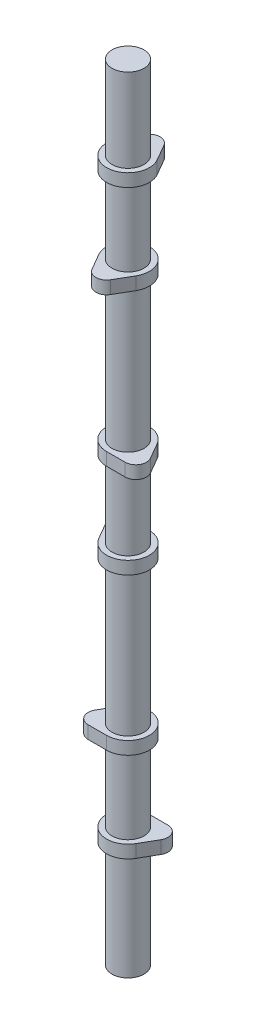
from build123d import *

# Parameters (mm, degrees)
BOSS_EXTRUDE1_DEPTH   = 7.62
LPATTERN2_COUNT       = 2
LPATTERN2_PITCH       = 53.34
BODY_MOVE_COPY1_ANGLE = 180
LPATTERN3_COUNT       = 3
LPATTERN3_PITCH       = 146.05
BODY_MOVE_COPY2_ANGLE = 120
BODY_MOVE_COPY3_ANGLE = 120
BOSS_EXTRUDE2_START   = 49.53
SKETCH3_R             = 9.5
BOSS_EXTRUDE2_DEPTH   = 466.09


with BuildPart() as part:
    # Sketch1 → Boss-Extrude1 (new body)
    with BuildSketch(Plane(origin=(0, 0, 0), x_dir=(1, 0, 0), z_dir=(0, 1, 0))):
        with BuildLine():
            Line((-5.499261314, 15.875), (-10.998522628, 6.35))
            ThreePointArc((-10.998522628, 6.35), (0, -12.7), (10.998522628, 6.35))
            Line((10.998522628, 6.35), (5.499261314, 15.875))
            ThreePointArc((5.499261314, 15.875), (0, 19.05), (-5.499261314, 15.875))
        make_face()
    extrude(amount=BOSS_EXTRUDE1_DEPTH)


with BuildPart() as lpattern2_1:
    # LPattern2: pattern copy
    add(part.part.moved(Location(Vector(0, -1, 0) * (1 * LPATTERN2_PITCH))))


with BuildPart() as lpattern2_1_1:
    # Body-Move/Copy1: moved
    add(lpattern2_1.part.rotate(Axis((0, 0, 0), (0, 1, 0)), BODY_MOVE_COPY1_ANGLE))


with BuildPart() as lpattern3_1:
    # LPattern3: pattern copy
    add(part.part.moved(Location(Vector(0, -1, 0) * (1 * LPATTERN3_PITCH))))


with BuildPart() as lpattern3_2:
    # LPattern3: pattern copy
    add(part.part.moved(Location(Vector(0, -1, 0) * (2 * LPATTERN3_PITCH))))


with BuildPart() as lpattern3_3:
    # LPattern3: pattern copy
    add(lpattern2_1_1.part.moved(Location(Vector(0, -1, 0) * (1 * LPATTERN3_PITCH))))


with BuildPart() as lpattern3_4:
    # LPattern3: pattern copy
    add(lpattern2_1_1.part.moved(Location(Vector(0, -1, 0) * (2 * LPATTERN3_PITCH))))


with BuildPart() as lpattern3_1_1:
    # Body-Move/Copy2: moved
    add(lpattern3_1.part.rotate(Axis((0, 0, 0), (0, -1, 0)), BODY_MOVE_COPY2_ANGLE))


with BuildPart() as lpattern3_3_1:
    # Body-Move/Copy2: moved
    add(lpattern3_3.part.rotate(Axis((0, 0, 0), (0, -1, 0)), BODY_MOVE_COPY2_ANGLE))


with BuildPart() as lpattern3_2_1:
    # Body-Move/Copy3: moved
    add(lpattern3_2.part.rotate(Axis((0, 0, 0), (0, 1, 0)), BODY_MOVE_COPY3_ANGLE))


with BuildPart() as lpattern3_4_1:
    # Body-Move/Copy3: moved
    add(lpattern3_4.part.rotate(Axis((0, 0, 0), (0, 1, 0)), BODY_MOVE_COPY3_ANGLE))


with BuildPart() as part_1:
    add(part.part)

    add(lpattern2_1_1.part)  # Boss-Extrude2 merges LPattern2_1

    add(lpattern3_1_1.part)  # Boss-Extrude2 merges LPattern3_1

    add(lpattern3_2_1.part)  # Boss-Extrude2 merges LPattern3_2

    add(lpattern3_3_1.part)  # Boss-Extrude2 merges LPattern3_3

    add(lpattern3_4_1.part)  # Boss-Extrude2 merges LPattern3_4
    # Sketch3 → Boss-Extrude2 (add)
    with BuildSketch(Plane(origin=(0, 7.62, 0), x_dir=(1, 0, 0), z_dir=(0, 1, 0)).offset(BOSS_EXTRUDE2_START)):
        Circle(SKETCH3_R)
    extrude(amount=-BOSS_EXTRUDE2_DEPTH)


solid = part_1.part
